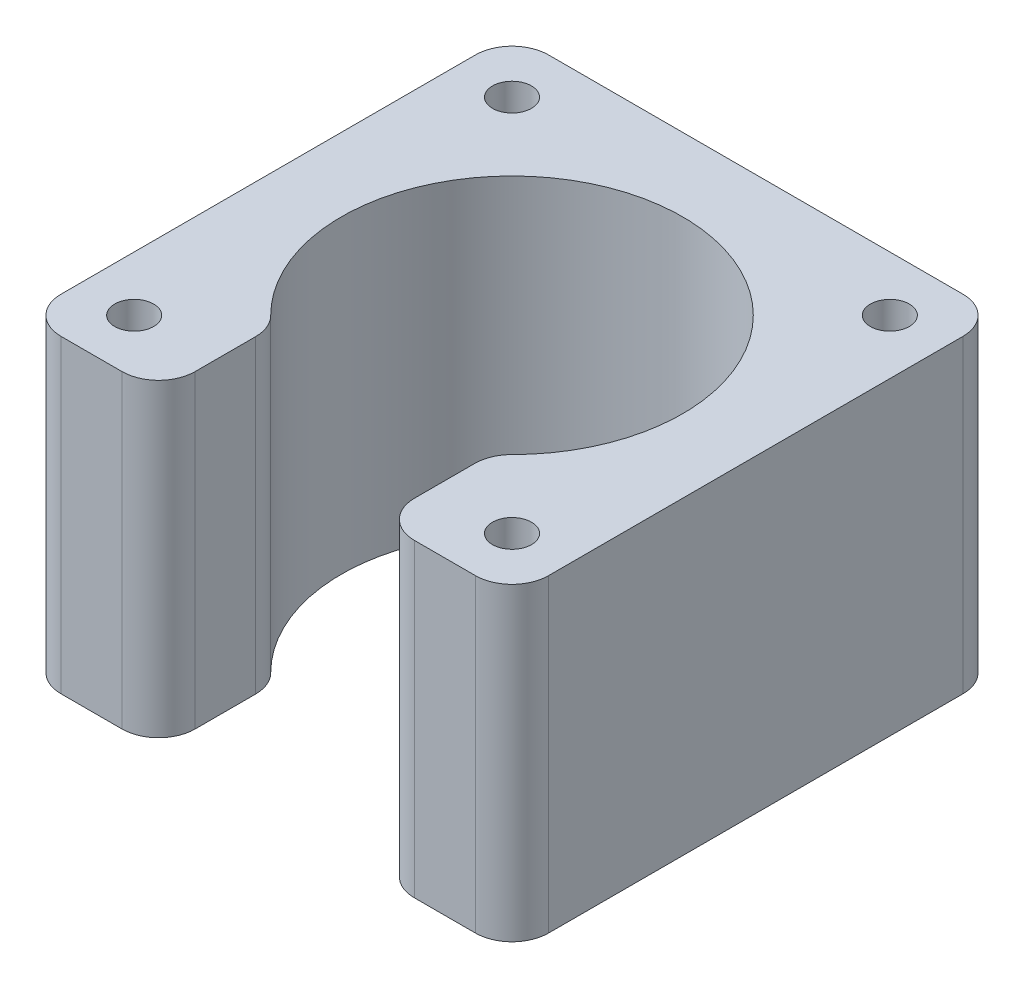
from build123d import *

# Parameters (mm, degrees)
BOSS_EXTRUDE1_DEPTH  = 25.4
M3_CLEARANCE_HOLE1_D = 3.2
FILLET1_R            = 3


with BuildPart() as part:
    # Sketch1 → Boss-Extrude1 (new body)
    with BuildSketch(Plane(origin=(0, 0, 0), x_dir=(1, 0, 0), z_dir=(0, 1, 0))):
        with BuildLine():
            Line((-20, -20), (-9, -20))
            Line((-9, -20), (-9, -10.723805295))
            ThreePointArc((-9, -10.723805295), (0, 14), (9, -10.723805295))
            Line((9, -10.723805295), (9, -20))
            Line((9, -20), (20, -20))
            Line((20, -20), (20, 20))
            Line((20, 20), (-20, 20))
            Line((-20, 20), (-20, -20))
        make_face()
    extrude(amount=-BOSS_EXTRUDE1_DEPTH)

    # M3 Clearance Hole1 (through all)
    with Locations(Plane(origin=(-15.5, 0, -15.5), x_dir=(0, 0, 1), z_dir=(0, 1, 0))):
        with Locations((0, 0), (0, 31), (31, 31), (31, 0)):
            Hole(M3_CLEARANCE_HOLE1_D / 2)

    # Fillet1
    fillet1_edges = [part.edges().sort_by_distance(p)[0] for p in [
        (-9, -12.7, 10.723805295),
        (-9, -12.7, 20),
        (-20, -12.7, 20),
        (-20, -12.7, -20),
        (20, -12.7, -20),
        (20, -12.7, 20),
        (9, -12.7, 20),
        (9, -12.7, 10.723805295),
    ]]
    fillet(fillet1_edges, radius=FILLET1_R)


solid = part.part
